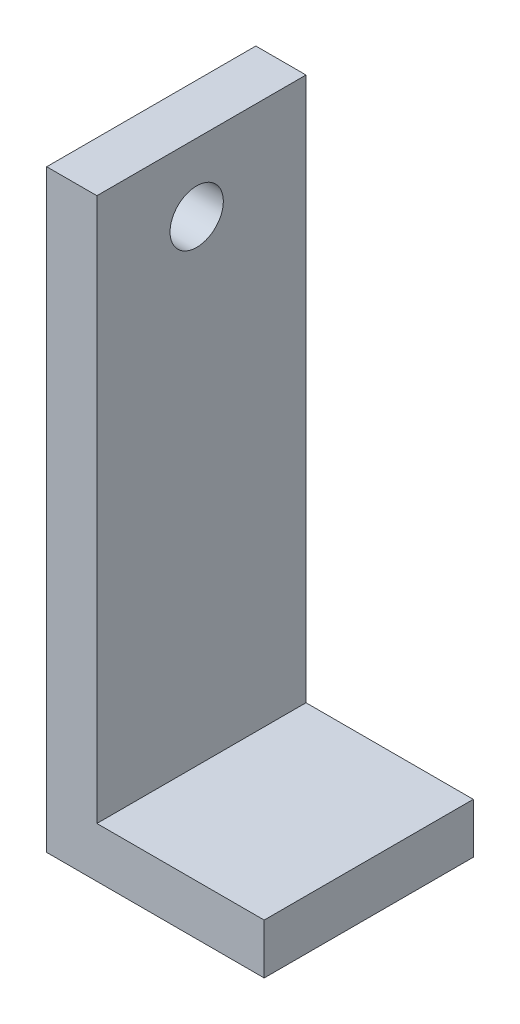
from build123d import *

# Parameters (mm, degrees)
SKETCH1_W           = 25
SKETCH1_H           = 71
BOSS_EXTRUDE1_DEPTH = 6
SKETCH2_W           = 25
SKETCH2_H           = 6
BOSS_EXTRUDE2_DEPTH = 20
SKETCH3_R           = 3.187620356
CUT_EXTRUDE1_DEPTH  = 22.5


with BuildPart() as part:
    # Sketch1 → Boss-Extrude1 (new body)
    with BuildSketch(Plane(origin=(0, 0, 0), x_dir=(0, 0, -1), z_dir=(1, 0, 0))):
        with Locations((-12.5, -35.5)):
            Rectangle(SKETCH1_W, SKETCH1_H)
    extrude(amount=BOSS_EXTRUDE1_DEPTH)

    # Sketch2 → Boss-Extrude2 (add)
    with BuildSketch(Plane(origin=(6, 0, 0), x_dir=(0, 0, -1), z_dir=(1, 0, 0))):
        with Locations((-12.5, -68)):
            Rectangle(SKETCH2_W, SKETCH2_H)
    extrude(amount=BOSS_EXTRUDE2_DEPTH)

    # Sketch3 → Cut-Extrude1 (cut)
    with BuildSketch(Plane(origin=(6, 0, 0), x_dir=(0, 0, -1), z_dir=(1, 0, 0))):
        with Locations((-13.070218864, -8.129494521)):
            Circle(SKETCH3_R)
    extrude(amount=-CUT_EXTRUDE1_DEPTH, mode=Mode.SUBTRACT)


solid = part.part
